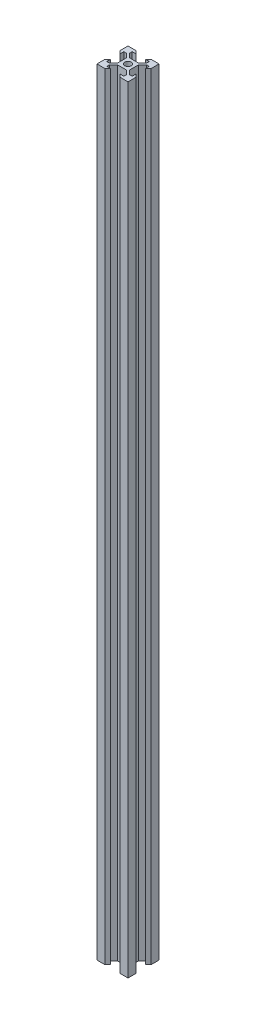
from build123d import *

# Parameters (mm, degrees)
SKETCH1_R           = 2.1
BOSS_EXTRUDE1_DEPTH = 500


with BuildPart() as part:
    # Sketch1 → Boss-Extrude1 (new body)
    with BuildSketch(Plane(origin=(0, 0, 0), x_dir=(1, 0, 0), z_dir=(0, 1, 0))):
        Polygon((-3.900660172, -2.84), (-3.900660172, 0), (-3.900660172, 2.84), (-6.56, 5.499339828), (-8.2, 5.499339828), (-8.2, 3.1), (-10, 4.9), (-10, 10), (-4.9, 10), (-3.1, 8.2), (-5.499339828, 8.2), (-5.499339828, 6.56), (-2.84, 3.900660172), (0, 3.900660172), (2.84, 3.900660172), (5.499339828, 6.56), (5.499339828, 8.2), (3.1, 8.2), (4.9, 10), (10, 10), (10, 4.9), (8.2, 3.1), (8.2, 5.499339828), (6.56, 5.499339828), (3.900660172, 2.84), (3.900660172, 0), (3.900660172, -2.84), (6.56, -5.499339828), (8.2, -5.499339828), (8.2, -3.1), (10, -4.9), (10, -10), (4.9, -10), (3.1, -8.2), (5.499339828, -8.2), (5.499339828, -6.56), (2.84, -3.900660172), (0, -3.900660172), (-2.84, -3.900660172), (-5.499339828, -6.56), (-5.499339828, -8.2), (-3.1, -8.2), (-4.9, -10), (-10, -10), (-10, -4.9), (-8.2, -3.1), (-8.2, -5.499339828), (-6.56, -5.499339828), align=None)
        with Locations(Location((0, 0, 0), (0, 0, 270))):
            Circle(SKETCH1_R, mode=Mode.SUBTRACT)
    extrude(amount=BOSS_EXTRUDE1_DEPTH)


solid = part.part
